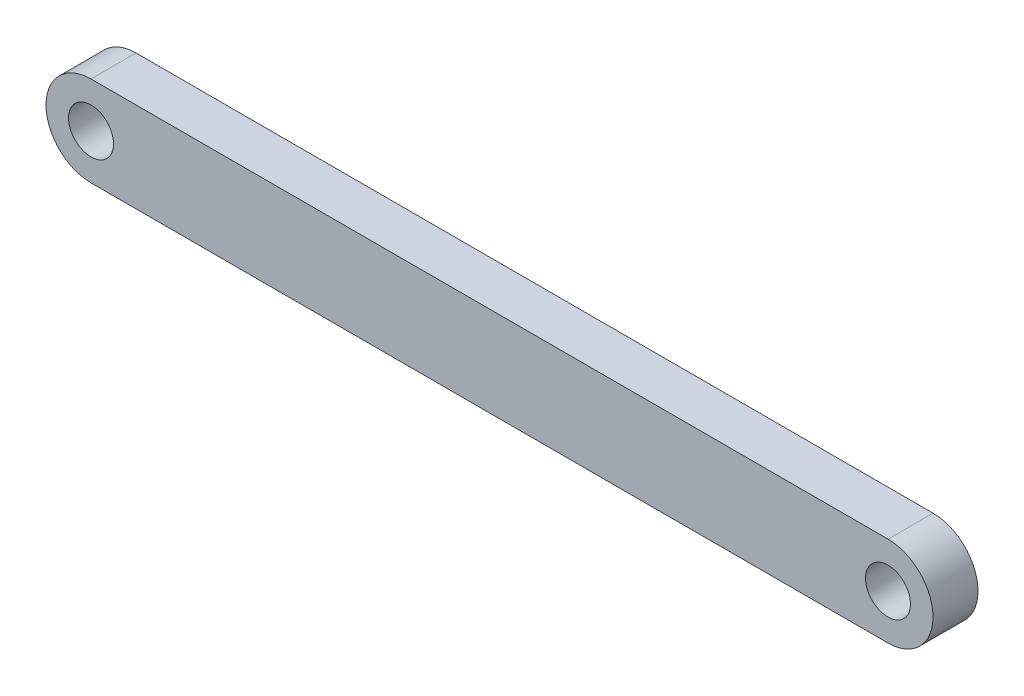
from build123d import *

# Parameters (mm, degrees)
SKETCH_1_R      = 1
EXTRUDE_1_DEPTH = 2


with BuildPart() as part:
    # 草圖1 → 填料-伸長1 (new body)
    with BuildSketch(Plane.XY):
        with BuildLine():
            Line((-17.709999976, 2.000913792), (17.710000024, 2.000913792))
            ThreePointArc((17.710000024, 2.000913792), (19.710000024, 0.000913792), (17.710000024, -1.999086208))
            Line((17.710000024, -1.999086208), (-17.709999976, -1.999086208))
            ThreePointArc((-17.709999976, -1.999086208), (-19.709999976, 0.000913792), (-17.709999976, 2.000913792))
        make_face()
        with Locations((-17.709999976, 0.000913792)):
            Circle(SKETCH_1_R, mode=Mode.SUBTRACT)
        with Locations((17.710000024, 0.000913792)):
            Circle(SKETCH_1_R, mode=Mode.SUBTRACT)
    extrude(amount=EXTRUDE_1_DEPTH)


solid = part.part
